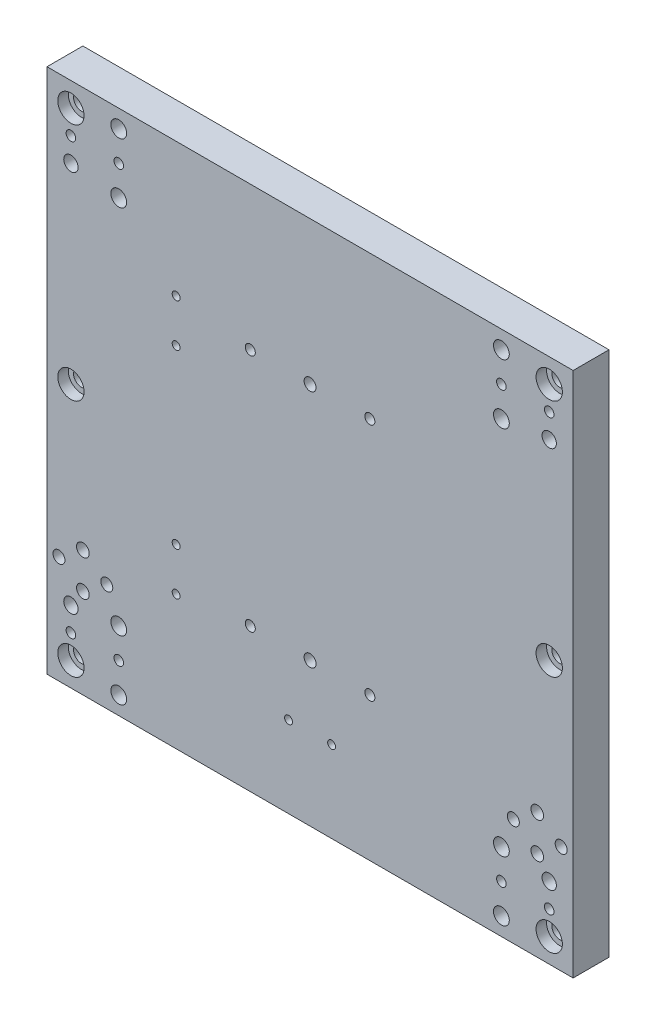
from build123d import *

# Parameters (mm, degrees)
SKIZZE1_W                                            = 220
SKIZZE1_H                                            = 220
AUFSATZ_LINEAR_AUSTRAGEN1_DEPTH                      = 15
F_6_0MM_STIFTLOCH1_D                                 = 6
F_5_0MM_STIFTLOCH1_D                                 = 5
M5_GEWINDEBOHRUNG1_D                                 = 4.2
STIRNSENKUNG_F_R_M6_ZYLINDERSCHRAUBE_MIT_D           = 6.6
STIRNSENKUNG_F_R_M6_ZYLINDERSCHRAUBE_MIT_CBORE_D     = 11
STIRNSENKUNG_F_R_M6_ZYLINDERSCHRAUBE_MIT_CBORE_DEPTH = 4.4
M4_GEWINDEBOHRUNG1_D                                 = 3.3
M4_GEWINDEBOHRUNG1_DEPTH                             = 11.5
M4_GEWINDEBOHRUNG1_TIP                               = 0.991420021
STIRNSENKUNG_F_R_M5_SECHSKANTSCHRAUBE_MI_D           = 5.3
STIRNSENKUNG_F_R_M5_SECHSKANTSCHRAUBE_MI_CBORE_D     = 10
STIRNSENKUNG_F_R_M5_SECHSKANTSCHRAUBE_MI_CBORE_DEPTH = 5.4
STIRNSENKUNG_F_R_M6_ZYLINDERSCHRAUBE_2_D             = 6.6
STIRNSENKUNG_F_R_M6_ZYLINDERSCHRAUBE_2_CBORE_D       = 11
STIRNSENKUNG_F_R_M6_ZYLINDERSCHRAUBE_2_CBORE_DEPTH   = 4.4
F_4_0MM_STIFTLOCH1_D                                 = 4


with BuildPart() as part:
    # Skizze1 → Aufsatz-Linear austragen1 (new body)
    with BuildSketch(Plane(origin=(0, 0, 0), x_dir=(-1, 0, 0), z_dir=(0, 0, -1))):
        Rectangle(SKIZZE1_W, SKIZZE1_H)
    extrude(amount=-AUFSATZ_LINEAR_AUSTRAGEN1_DEPTH)

    # Ø6.0mm Stiftloch1 (through all)
    with Locations(Plane(origin=(0, 0, 0), x_dir=(-1, 0, 0), z_dir=(0, 0, -1))):
        with Locations((-100, -80), (-100, 80), (100, 80), (100, -80)):
            Hole(F_6_0MM_STIFTLOCH1_D / 2)

    # Ø5.0mm Stiftloch1 (through all)
    with Locations(Plane(origin=(0, 0, 0), x_dir=(-1, 0, 0), z_dir=(0, 0, -1))):
        with Locations((0, 50), (0, -50), (105, -65), (85, -65), (-85, -65), (-105, -65)):
            Hole(F_5_0MM_STIFTLOCH1_D / 2)

    # M5 Gewindebohrung1 (through all)
    with Locations(Plane.XY.offset(15)):
        with Locations((-25, 50), (25, 50), (25, -50), (-25, -50)):
            Hole(M5_GEWINDEBOHRUNG1_D / 2)

    # Stirnsenkung f_r M6 Zylinderschraube mit (through all)
    with Locations(Plane.XY.offset(15)):
        with Locations((100, -100), (100, 0), (-100, -100), (-100, 0), (-100, 100), (100, 100)):
            CounterBoreHole(STIRNSENKUNG_F_R_M6_ZYLINDERSCHRAUBE_MIT_D / 2, STIRNSENKUNG_F_R_M6_ZYLINDERSCHRAUBE_MIT_CBORE_D / 2, STIRNSENKUNG_F_R_M6_ZYLINDERSCHRAUBE_MIT_CBORE_DEPTH)

    # M4 Gewindebohrung1
    with Locations(Plane.XY.offset(15)):
        with Locations((-56, 54), (-56, 36), (-56, -36), (-56, -54), (9, -76), (-9, -76)):
            Hole(M4_GEWINDEBOHRUNG1_D / 2, depth=M4_GEWINDEBOHRUNG1_DEPTH)
            with Locations((0, 0, -(M4_GEWINDEBOHRUNG1_DEPTH + M4_GEWINDEBOHRUNG1_TIP / 2))):  # 118° drill point
                Cone(0, M4_GEWINDEBOHRUNG1_D / 2, M4_GEWINDEBOHRUNG1_TIP, mode=Mode.SUBTRACT)

    # Stirnsenkung für M5 Sechskantschraube mit Schaft1 (through all)
    with Locations(Plane(origin=(0, 0, 0), x_dir=(-1, 0, 0), z_dir=(0, 0, -1))):
        with Locations((95, -57.5), (95, -72.5), (-95, -57.5), (-95, -72.5)):
            CounterBoreHole(STIRNSENKUNG_F_R_M5_SECHSKANTSCHRAUBE_MI_D / 2, STIRNSENKUNG_F_R_M5_SECHSKANTSCHRAUBE_MI_CBORE_D / 2, STIRNSENKUNG_F_R_M5_SECHSKANTSCHRAUBE_MI_CBORE_DEPTH)

    # Stirnsenkung f_r M6 Zylinderschraube 2 (through all)
    with Locations(Plane(origin=(0, 0, 0), x_dir=(-1, 0, 0), z_dir=(0, 0, -1))):
        with Locations((-80, 102.5), (-80, 77.5), (80, 77.5), (80, 102.5), (80, -77.5), (80, -102.5), (-80, -77.5), (-80, -102.5)):
            CounterBoreHole(STIRNSENKUNG_F_R_M6_ZYLINDERSCHRAUBE_2_D / 2, STIRNSENKUNG_F_R_M6_ZYLINDERSCHRAUBE_2_CBORE_D / 2, STIRNSENKUNG_F_R_M6_ZYLINDERSCHRAUBE_2_CBORE_DEPTH)

    # Ø4.0mm Stiftloch1 (through all)
    with Locations(Plane(origin=(0, 0, 0), x_dir=(-1, 0, 0), z_dir=(0, 0, -1))):
        with Locations((-100, 90), (-80, 90), (80, 90), (100, 90), (100, -90), (80, -90), (-80, -90), (-100, -90)):
            Hole(F_4_0MM_STIFTLOCH1_D / 2)


solid = part.part
